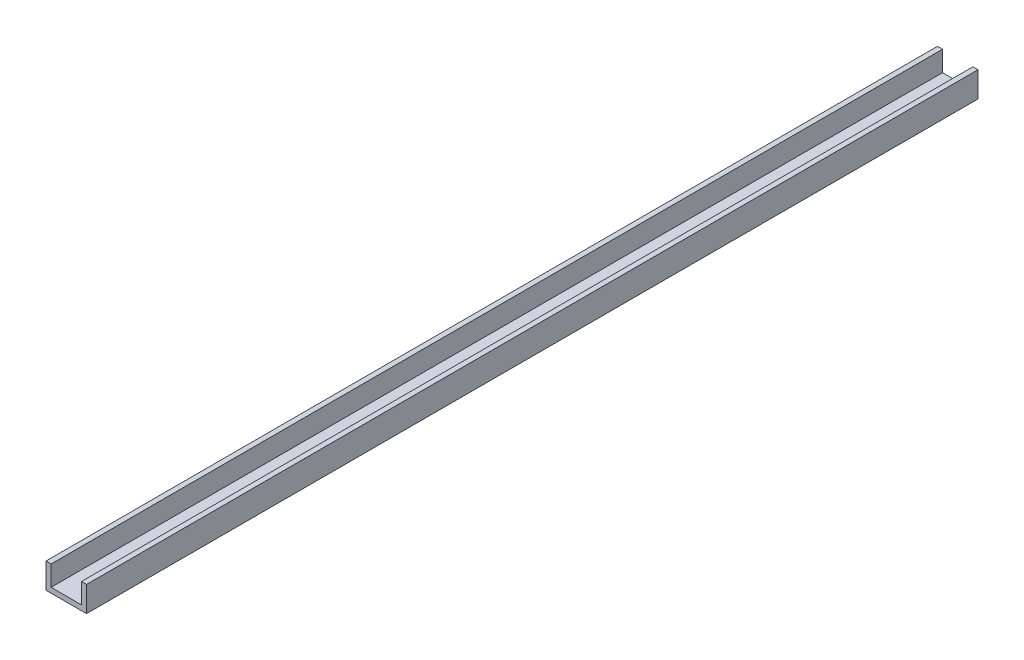
from build123d import *

# Parameters (mm, degrees)
BOSS_EXTRUDE2_DEPTH = 609.6
SKETCH4_W           = 17.43115111
SKETCH4_H           = 13.311100502
CUT_EXTRUDE1_DEPTH  = 939.8
SKETCH5_R           = 1.5875
CUT_EXTRUDE2_DEPTH  = 610.684743459
CHAMFER1_SIZE       = 1.27


with BuildPart() as part:
    # Sketch3 → Boss-Extrude2 (new, symmetric)
    with BuildSketch(Plane.XY):
        Polygon((-6.35, 3.96875), (-6.35, -3.96875), (6.35, -3.96875), (6.35, 3.96875), (4.7625, 3.96875), (4.7625, -2.38125), (-4.7625, -2.38125), (-4.7625, 3.96875), align=None)
    extrude(amount=BOSS_EXTRUDE2_DEPTH, both=True)

    # Sketch4 → Cut-Extrude1 (cut)
    with BuildSketch(Plane.XY.offset(-609.6)):
        Rectangle(SKETCH4_W, SKETCH4_H)
    extrude(amount=CUT_EXTRUDE1_DEPTH, mode=Mode.SUBTRACT)

    # Sketch5 → Cut-Extrude2 (cut, through all)
    with BuildSketch(Plane.XZ.offset(3.96875)):
        with Locations(Location((0, 584.2, 0), (0, 0, 270))):
            Circle(SKETCH5_R)
    extrude(amount=-CUT_EXTRUDE2_DEPTH, mode=Mode.SUBTRACT)

    # Chamfer1
    chamfer1_edges = [part.edges().sort_by_distance(p)[0] for p in [
        (0, -3.96875, 585.7875),
    ]]
    chamfer(chamfer1_edges, length=CHAMFER1_SIZE)


solid = part.part
